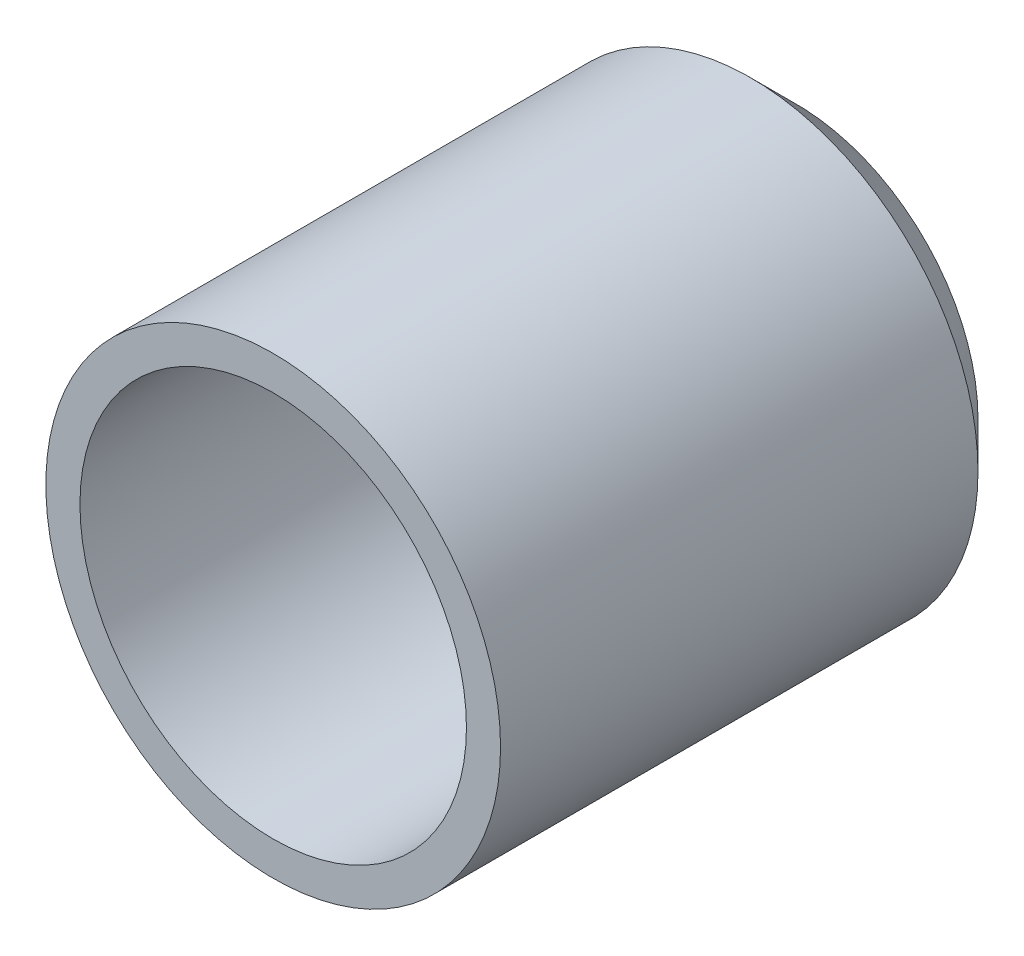
from build123d import *

# Parameters (mm, degrees)
CROQUIS1_R              = 10
SALIENTE_EXTRUIR1_DEPTH = 23
CHAFL_N1_SIZE           = 2
CROQUIS2_R              = 8.5
CORTAR_EXTRUIR1_DEPTH   = 15


with BuildPart() as part:
    # Croquis1 → Saliente-Extruir1 (new body)
    with BuildSketch(Plane.XY):
        Circle(CROQUIS1_R)
    extrude(amount=-SALIENTE_EXTRUIR1_DEPTH)

    # Chaflán1
    chafl_n1_edges = [part.edges().sort_by_distance(p)[0] for p in [
        (-10, 0, -23),
    ]]
    chamfer(chafl_n1_edges, length=CHAFL_N1_SIZE)

    # Croquis2 → Cortar-Extruir1 (cut)
    with BuildSketch(Plane.XY):
        Circle(CROQUIS2_R)
    extrude(amount=-CORTAR_EXTRUIR1_DEPTH, mode=Mode.SUBTRACT)


solid = part.part
